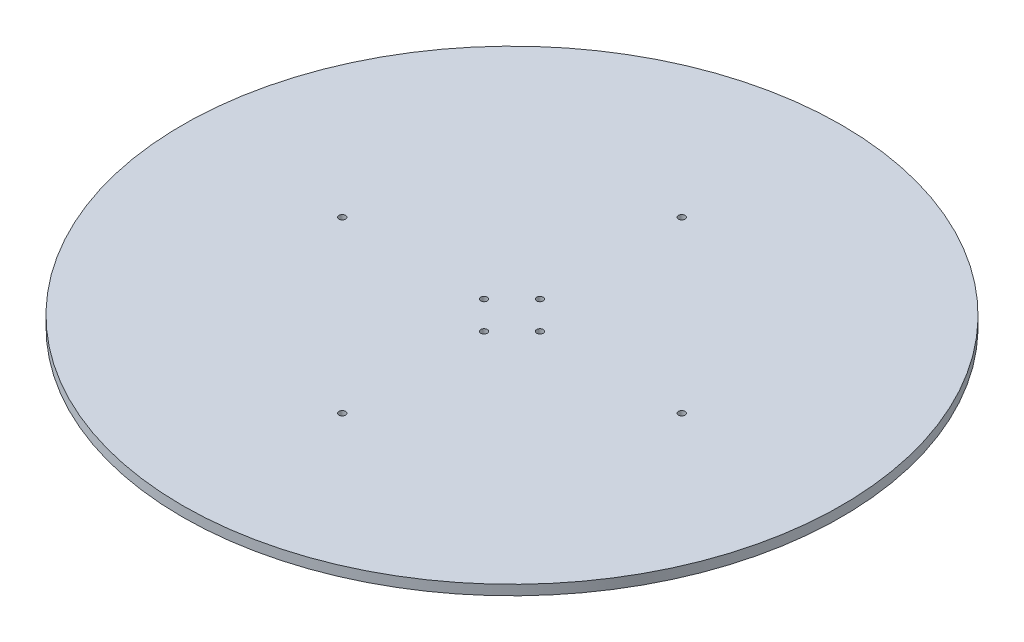
from build123d import *

# Parameters (mm, degrees)
SKETCH1_R           = 165
SKETCH1_R_2         = 1.65
BOSS_EXTRUDE1_DEPTH = 5


with BuildPart() as part:
    # Sketch1 → Boss-Extrude1 (new body)
    with BuildSketch(Plane(origin=(0, 0, 0), x_dir=(1, 0, 0), z_dir=(0, 1, 0))):
        with Locations(Location((0, 0, 0), (0, 0, 270))):
            Circle(SKETCH1_R)
        with Locations(Location((14, 0, 0), (0, 0, 270))):
            Circle(SKETCH1_R_2, mode=Mode.SUBTRACT)
        with Locations(Location((0, -14, 0), (0, 0, 270))):
            Circle(SKETCH1_R_2, mode=Mode.SUBTRACT)
        with Locations(Location((-14, 0, 0), (0, 0, 270))):
            Circle(SKETCH1_R_2, mode=Mode.SUBTRACT)
        with Locations(Location((0, 14, 0), (0, 0, 270))):
            Circle(SKETCH1_R_2, mode=Mode.SUBTRACT)
        with Locations(Location((85, 0, 0), (0, 0, 270))):
            Circle(SKETCH1_R_2, mode=Mode.SUBTRACT)
        with Locations(Location((0, -85, 0), (0, 0, 270))):
            Circle(SKETCH1_R_2, mode=Mode.SUBTRACT)
        with Locations(Location((-85, 0, 0), (0, 0, 270))):
            Circle(SKETCH1_R_2, mode=Mode.SUBTRACT)
        with Locations(Location((0, 85, 0), (0, 0, 270))):
            Circle(SKETCH1_R_2, mode=Mode.SUBTRACT)
    extrude(amount=BOSS_EXTRUDE1_DEPTH)


solid = part.part
